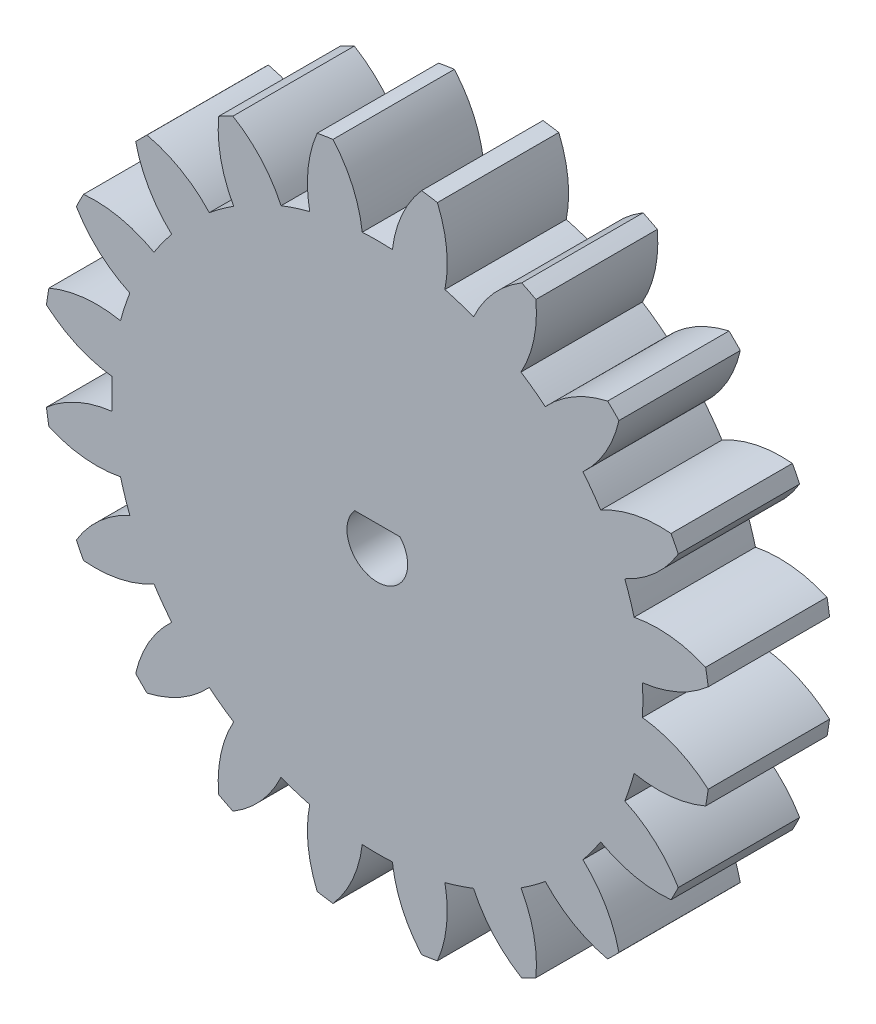
from build123d import *

# Parameters (mm, degrees)
ESBO_O1_W             = 33
ESBO_O1_H             = 12
CORTE_EXTRUS_O2_DEPTH = 49.187135213
CORTE_EXTRUS_O3_DEPTH = 49.187135213
PADR_OCIRCULAR2_COUNT = 20


with BuildPart() as part:
    # Esboço1 → Revolução1 (revolve)
    with BuildSketch(Plane(origin=(0, 0, 0), x_dir=(1, 0, 0), z_dir=(0, 1, 0)), mode=Mode.PRIVATE) as revolu_o1_sk:
        with Locations((16.5, 6)):
            Rectangle(ESBO_O1_W, ESBO_O1_H)
    revolve(revolu_o1_sk.sketch.rotate(Axis((0, 0, 0), (0, 0, 1)), 180), axis=Axis((0, 0, 0), (0, 0, 1)))

    # Esboço3 → Corte-extrusão2 (cut, through all)
    with BuildSketch(Plane(origin=(0, 0, -12), x_dir=(-1, 0, 0), z_dir=(0, 0, -1))):
        with BuildLine():
            Line((-2.236067977, 2), (2.236067977, 2))
            ThreePointArc((2.236067977, 2), (0, -3), (-2.236067977, 2))
        make_face()
    extrude(amount=-CORTE_EXTRUS_O2_DEPTH, mode=Mode.SUBTRACT)

    # Esboço2 → Corte-extrusão3 (cut, through all)
    with BuildSketch(Plane.XY):
        with BuildLine():
            ThreePointArc((1.489278925, 26.206717637), (0, 26.249), (-1.489278925, 26.206717637))
            ThreePointArc((-1.489278925, 26.206717637), (-2.448651415, 29.690511169), (-4.401620335, 32.730762038))
            ThreePointArc((-4.401620335, 32.730762038), (0, 33.0254), (4.401620335, 32.730762038))
            ThreePointArc((4.401620335, 32.730762038), (2.448651415, 29.690511169), (1.489278925, 26.206717637))
        make_face()
    corte_extrus_o3 = extrude(amount=-CORTE_EXTRUS_O3_DEPTH, mode=Mode.SUBTRACT)

    # PadrãoCircular2: Corte-extrusão3 ×20 about axis
    padr_ocircular2_axis = Axis((0, 0, 0), (0, 0, 1))
    for i in range(1, PADR_OCIRCULAR2_COUNT):
        add(corte_extrus_o3.rotate(padr_ocircular2_axis, i * 360 / PADR_OCIRCULAR2_COUNT), mode=Mode.SUBTRACT)


solid = part.part
